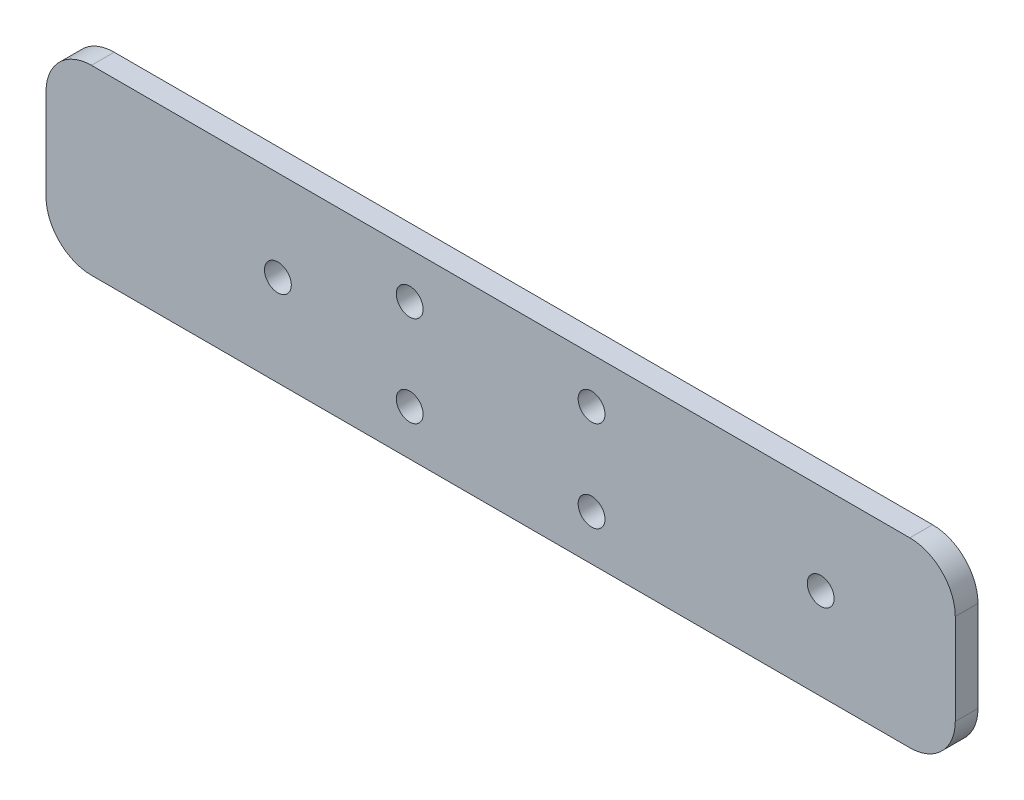
from build123d import *

# Parameters (mm, degrees)
CROQUIS1_W            = 200
CROQUIS1_H            = 40
EXTRUIR1_DEPTH        = 2.5
REDONDEO1_R           = 10
CROQUIS2_R            = 2.95
CORTAR_EXTRUIR1_DEPTH = 10
CROQUIS3_R            = 2.95
CORTAR_EXTRUIR2_DEPTH = 10
CROQUIS4_R            = 2.95
CORTAR_EXTRUIR3_DEPTH = 10


with BuildPart() as part:
    # Croquis1 → Extruir1 (new, symmetric)
    with BuildSketch(Plane.XY):
        with Locations((-25, -5)):
            Rectangle(CROQUIS1_W, CROQUIS1_H)
    extrude(amount=EXTRUIR1_DEPTH, both=True)

    # Redondeo1
    redondeo1_edges = [part.edges().sort_by_distance(p)[0] for p in [
        (75, 15, 0),
        (75, -25, 0),
        (-125, -25, 0),
        (-125, 15, 0),
    ]]
    fillet(redondeo1_edges, radius=REDONDEO1_R)

    # Croquis2 → Cortar-Extruir1 (cut)
    with BuildSketch(Plane(origin=(0, 0, -2.5), x_dir=(-1, 0, 0), z_dir=(0, 0, -1))):
        with Locations((73.999510292, -4.90303525)):
            Circle(CROQUIS2_R)
    extrude(amount=-CORTAR_EXTRUIR1_DEPTH, mode=Mode.SUBTRACT)

    # Croquis3 → Cortar-Extruir2 (cut)
    with BuildSketch(Plane.XY.offset(2.5)):
        with Locations((-45, 5)):
            Circle(CROQUIS3_R)
        with Locations((-5, 5)):
            Circle(CROQUIS3_R)
        with Locations((-45, -15)):
            Circle(CROQUIS3_R)
        with Locations((-5, -15)):
            Circle(CROQUIS3_R)
    extrude(amount=-CORTAR_EXTRUIR2_DEPTH, mode=Mode.SUBTRACT)

    # Croquis4 → Cortar-Extruir3 (cut)
    with BuildSketch(Plane.XY.offset(2.5)):
        with Locations((45.400489708, -4.90303525)):
            Circle(CROQUIS4_R)
    extrude(amount=-CORTAR_EXTRUIR3_DEPTH, mode=Mode.SUBTRACT)


solid = part.part
